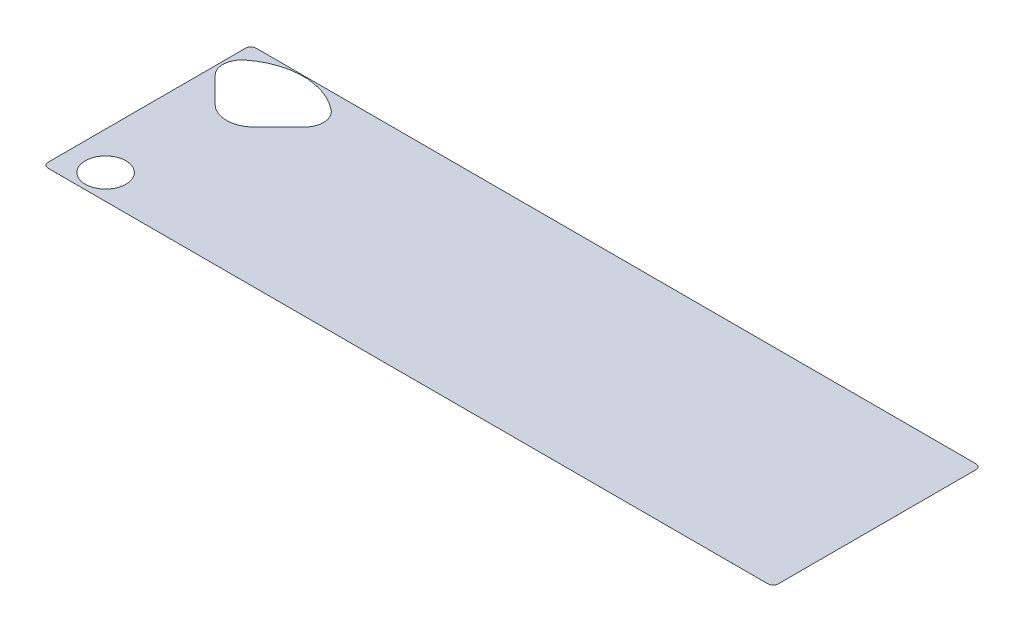
from build123d import *

# Parameters (mm, degrees)
BOSS_EXTRUDE1_START = -122.174
SKETCH2_R           = 46.83
BOSS_EXTRUDE1_DEPTH = 0.005


with BuildPart() as part:
    # Sketch2 → Boss-Extrude1 (new body)
    with BuildSketch(Plane(origin=(0, 0, 0), x_dir=(1, 0, 0), z_dir=(0, 1, 0)).offset(BOSS_EXTRUDE1_START)):
        with BuildLine():
            Line((-841.209630395, -227.338277778), (-841.209630395, 227.338277778))
            add(Edge.make_bspline(
                [(-841.209630395, 227.338277778), (-841.209630395, 228.9412629), (-840.578161906, 232.191113095), (-837.861109298, 236.262109298), (-833.790113095, 238.979161906), (-830.5402629, 239.610630395), (-828.937277778, 239.610630395)],
                knots=[-0.770319033, -0.770319033, -0.770319033, -0.770319033, -0.385159516, 0, 0.385159516, 0.770319033, 0.770319033, 0.770319033, 0.770319033], degree=3))
            Line((-828.937277778, 239.610630395), (828.937277778, 239.610630395))
            add(Edge.make_bspline(
                [(828.937277778, 239.610630395), (830.5402629, 239.610630395), (833.790113095, 238.979161906), (837.861109298, 236.262109298), (840.578161906, 232.191113095), (841.209630395, 228.9412629), (841.209630395, 227.338277778)],
                knots=[-0.770319033, -0.770319033, -0.770319033, -0.770319033, -0.385159516, 0, 0.385159516, 0.770319033, 0.770319033, 0.770319033, 0.770319033], degree=3))
            Line((841.209630395, 227.338277778), (841.209630395, -227.338277778))
            add(Edge.make_bspline(
                [(841.209630395, -227.338277778), (841.209630395, -228.9412629), (840.578161906, -232.191113095), (837.861109298, -236.262109298), (833.790113095, -238.979161906), (830.5402629, -239.610630395), (828.937277778, -239.610630395)],
                knots=[-0.770319033, -0.770319033, -0.770319033, -0.770319033, -0.385159516, 0, 0.385159516, 0.770319033, 0.770319033, 0.770319033, 0.770319033], degree=3))
            Line((828.937277778, -239.610630395), (-828.937277778, -239.610630395))
            add(Edge.make_bspline(
                [(-828.937277778, -239.610630395), (-830.5402629, -239.610630395), (-833.790113095, -238.979161906), (-837.861109298, -236.262109298), (-840.578161906, -232.191113095), (-841.209630395, -228.9412629), (-841.209630395, -227.338277778)],
                knots=[-0.770319033, -0.770319033, -0.770319033, -0.770319033, -0.385159516, 0, 0.385159516, 0.770319033, 0.770319033, 0.770319033, 0.770319033], degree=3))
        make_face()
        with Locations(Location((-754.506388348, -181.844577047, 0), (0, 0, 90))):
            Circle(SKETCH2_R, mode=Mode.SUBTRACT)
        with BuildLine():
            Line((-822.249073579, 138.296696732), (-763.86109258, 79.908715733))
            ThreePointArc((-763.86109258, 79.908715733), (-719.067867535, 61.354754417), (-674.274642491, 79.908715733))
            Line((-674.274642491, 79.908715733), (-615.886661491, 138.296696732))
            ThreePointArc((-615.886661491, 138.296696732), (-603.25398635, 171.291776492), (-619.37596705, 202.729675721))
            ThreePointArc((-619.37596705, 202.729675721), (-719.067867535, 237.83718636), (-818.75976802, 202.729675721))
            ThreePointArc((-818.75976802, 202.729675721), (-834.88174872, 171.291776492), (-822.249073579, 138.296696732))
        make_face(mode=Mode.SUBTRACT)
    extrude(amount=BOSS_EXTRUDE1_DEPTH)


solid = part.part
